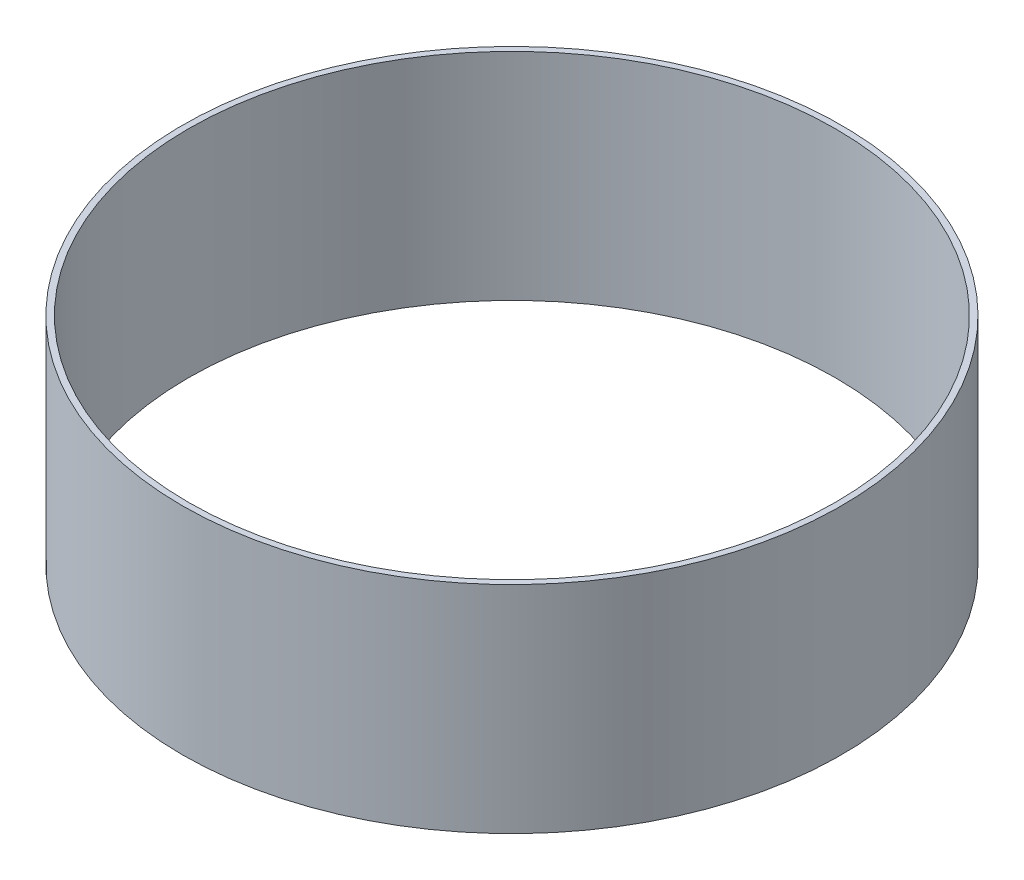
from build123d import *

# Parameters (mm, degrees)
SKETCH1_R           = 77.6224
SKETCH1_R_2         = 76.2
BOSS_EXTRUDE1_DEPTH = 25.4


with BuildPart() as part:
    # Sketch1 → Boss-Extrude1 (new, symmetric)
    with BuildSketch(Plane(origin=(0, 0, 0), x_dir=(1, 0, 0), z_dir=(0, 1, 0))):
        with Locations(Location((0, 0, 0), (0, 0, 270))):
            Circle(SKETCH1_R)
        with Locations(Location((0, 0, 0), (0, 0, 270))):
            Circle(SKETCH1_R_2, mode=Mode.SUBTRACT)
    extrude(amount=BOSS_EXTRUDE1_DEPTH, both=True)


solid = part.part
